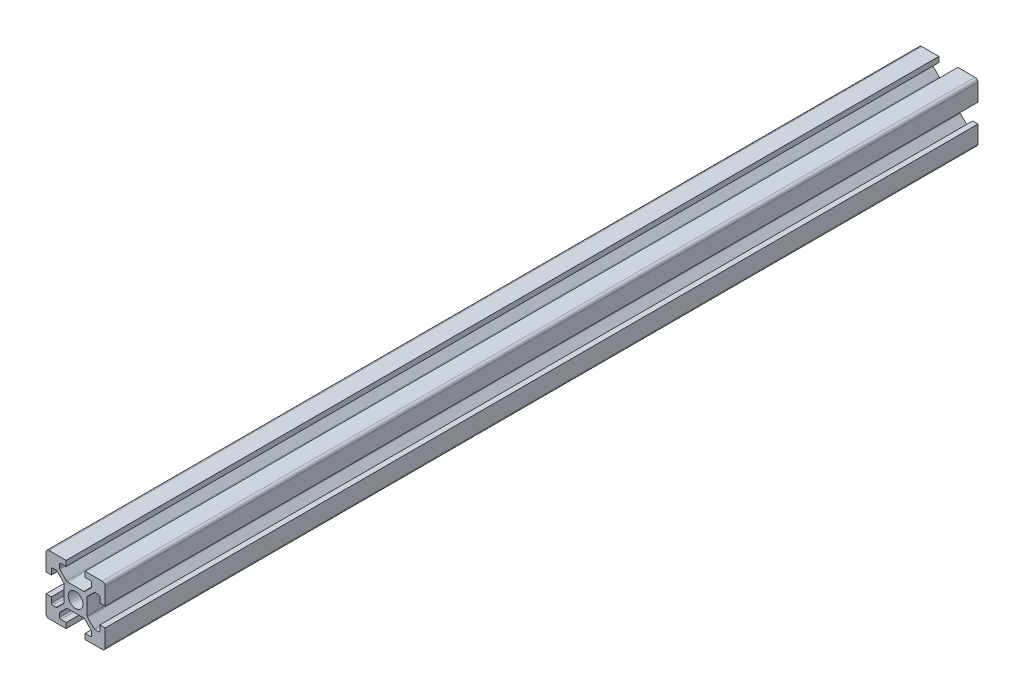
from build123d import *

# Parameters (mm, degrees)
SKETCH1_R           = 2.5
BOSS_EXTRUDE1_DEPTH = 295
FILLET1_R           = 1
FILLET2_R           = 0.5
FILLET3_R           = 0.5
FILLET4_R           = 0.5
FILLET5_R           = 0.5


with BuildPart() as part:
    # Sketch1 → Boss-Extrude1 (new body)
    with BuildSketch(Plane.XY):
        Polygon((13.2, 0), (13.2, 1.8), (15.45, 1.8), (15.45, 3.6), (12.95, 6.1), (7.05, 6.1), (4.55, 3.6), (4.55, 1.8), (6.8, 1.8), (6.8, 0), (0, 0), (0, 6.8), (1.8, 6.8), (1.8, 4.55), (3.6, 4.55), (6.1, 7.05), (6.1, 12.95), (3.6, 15.45), (1.8, 15.45), (1.8, 13.2), (0, 13.2), (0, 20), (6.8, 20), (6.8, 18.2), (4.55, 18.2), (4.55, 16.4), (7.05, 13.9), (12.95, 13.9), (15.45, 16.4), (15.45, 18.2), (13.2, 18.2), (13.2, 20), (20, 20), (20, 13.2), (18.2, 13.2), (18.2, 15.45), (16.4, 15.45), (13.9, 12.95), (13.9, 7.05), (16.4, 4.55), (18.2, 4.55), (18.2, 6.8), (20, 6.8), (20, 0), align=None)
        with Locations((10, 10)):
            Circle(SKETCH1_R, mode=Mode.SUBTRACT)
    extrude(amount=BOSS_EXTRUDE1_DEPTH)

    # Fillet1
    fillet1_edges = [part.edges().sort_by_distance(p)[0] for p in [
        (0, 0, 147.5),
        (0, 20, 147.5),
        (20, 20, 147.5),
        (20, 0, 147.5),
    ]]
    fillet(fillet1_edges, radius=FILLET1_R)

    # Fillet2
    fillet2_edges = [part.edges().sort_by_distance(p)[0] for p in [
        (4.55, 18.2, 147.5),
        (4.55, 16.4, 147.5),
        (7.05, 13.9, 147.5),
        (12.95, 13.9, 147.5),
        (15.45, 16.4, 147.5),
        (15.45, 18.2, 147.5),
    ]]
    fillet(fillet2_edges, radius=FILLET2_R)

    # Fillet3
    fillet3_edges = [part.edges().sort_by_distance(p)[0] for p in [
        (18.2, 15.45, 147.5),
        (16.4, 15.45, 147.5),
        (13.9, 12.95, 147.5),
        (13.9, 7.05, 147.5),
        (16.4, 4.55, 147.5),
        (18.2, 4.55, 147.5),
    ]]
    fillet(fillet3_edges, radius=FILLET3_R)

    # Fillet4
    fillet4_edges = [part.edges().sort_by_distance(p)[0] for p in [
        (1.8, 4.55, 147.5),
        (3.6, 4.55, 147.5),
        (6.1, 7.05, 147.5),
        (6.1, 12.95, 147.5),
        (3.6, 15.45, 147.5),
        (1.8, 15.45, 147.5),
    ]]
    fillet(fillet4_edges, radius=FILLET4_R)

    # Fillet5
    fillet5_edges = [part.edges().sort_by_distance(p)[0] for p in [
        (15.45, 1.8, 147.5),
        (15.45, 3.6, 147.5),
        (12.95, 6.1, 147.5),
        (7.05, 6.1, 147.5),
        (4.55, 3.6, 147.5),
        (4.55, 1.8, 147.5),
    ]]
    fillet(fillet5_edges, radius=FILLET5_R)


solid = part.part
